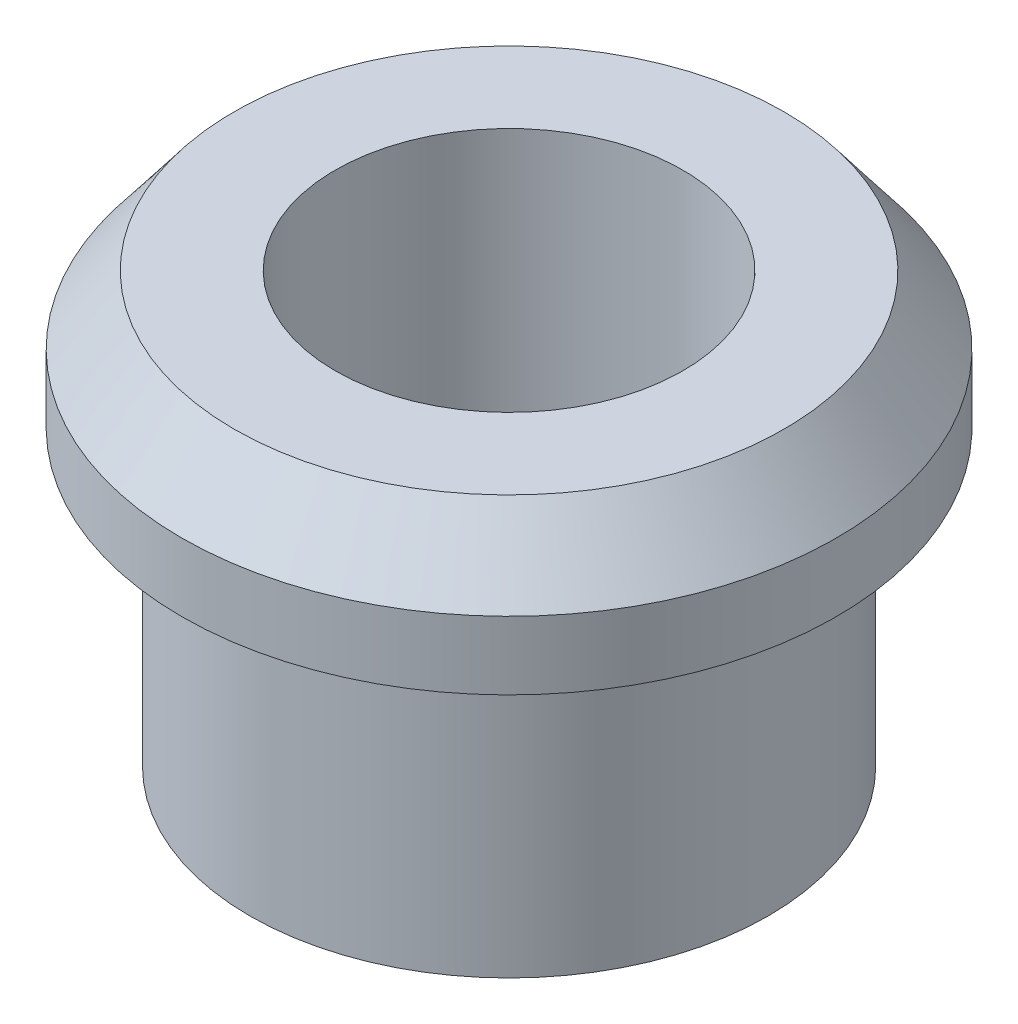
from build123d import *

# Parameters (mm, degrees)
F_3_8_24_TAPPED_HOLE1_D = 8.4328


with BuildPart() as part:
    # Sketch1 → Revolve1 (revolve)
    with BuildSketch(Plane.XY, mode=Mode.PRIVATE) as revolve1_sk:
        Polygon((0, 5.498310654), (0, -4.915689346), (6.2865, -4.915689346), (6.2865, 2.196310654), (7.9375, 2.196310654), (7.9375, 3.847310654), (6.6675, 5.498310654), align=None)
    revolve(revolve1_sk.sketch.rotate(Axis((0, 5.498310654, 0), (0, -1, 0)), 90), axis=Axis((0, 5.498310654, 0), (0, -1, 0)))

    # 3/8-24 Tapped Hole1 (through all)
    with Locations(Plane(origin=(0, 5.498310654, 0), x_dir=(1, 0, 0), z_dir=(0, 1, 0))):
        with Locations((0, 0)):
            Hole(F_3_8_24_TAPPED_HOLE1_D / 2)


solid = part.part
